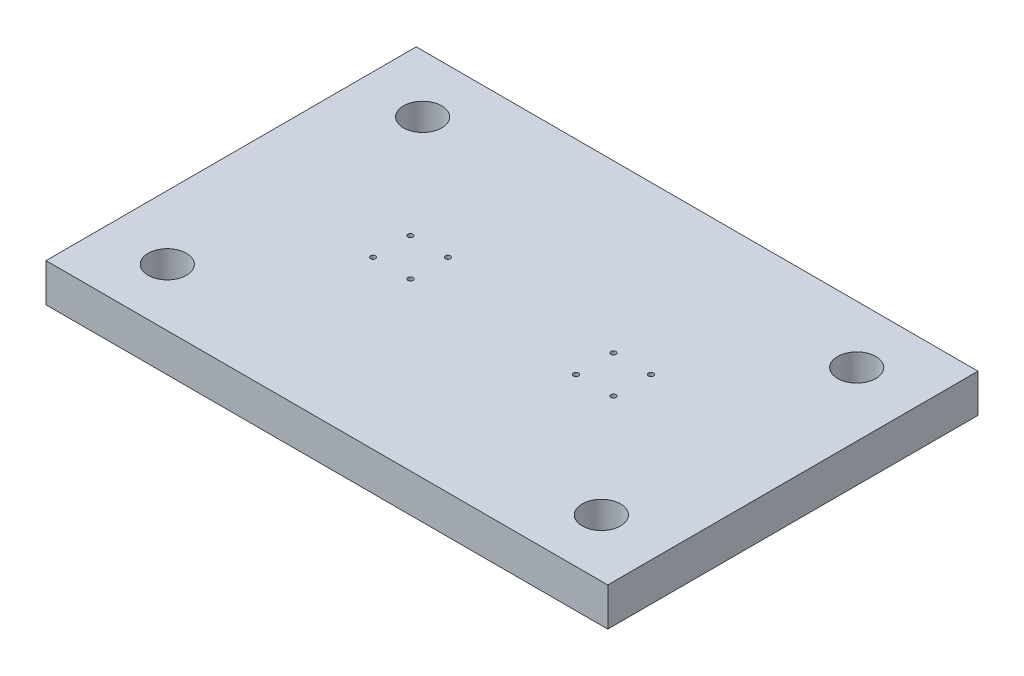
from build123d import *

# Parameters (mm, degrees)
SKETCH1_W           = 880
SKETCH1_H           = 580
BOSS_EXTRUDE1_DEPTH = 60
SKETCH2_R           = 30
CUT_EXTRUDE1_DEPTH  = 260
SKETCH4_R           = 4
CUT_EXTRUDE3_DEPTH  = 260


with BuildPart() as part:
    # Sketch1 → Boss-Extrude1 (new body)
    with BuildSketch(Plane(origin=(0, 0, 0), x_dir=(1, 0, 0), z_dir=(0, 1, 0))):
        Rectangle(SKETCH1_W, SKETCH1_H)
    extrude(amount=BOSS_EXTRUDE1_DEPTH)

    # Sketch2 → Cut-Extrude1 (cut)
    with BuildSketch(Plane(origin=(0, 60, 0), x_dir=(1, 0, 0), z_dir=(0, 1, 0))):
        with Locations(Location((-340, 200, 0), (0, 0, 270))):
            Circle(SKETCH2_R)
        with Locations(Location((340, 200, 0), (0, 0, 270))):
            Circle(SKETCH2_R)
        with Locations(Location((340, -200, 0), (0, 0, 270))):
            Circle(SKETCH2_R)
        with Locations(Location((-340, -200, 0), (0, 0, 270))):
            Circle(SKETCH2_R)
    extrude(amount=-CUT_EXTRUDE1_DEPTH, mode=Mode.SUBTRACT)

    # Sketch4 → Cut-Extrude3 (cut)
    with BuildSketch(Plane(origin=(0, 60, 0), x_dir=(1, 0, 0), z_dir=(0, 1, 0))):
        with Locations(Location((-129.655068581, 29.344931419, 0), (0, 0, 270))):
            Circle(SKETCH4_R)
        with Locations(Location((-129.655068581, -29.344931419, 0), (0, 0, 270))):
            Circle(SKETCH4_R)
        with Locations(Location((-188.344931419, -29.344931419, 0), (0, 0, 270))):
            Circle(SKETCH4_R)
        with Locations(Location((-188.344931419, 29.344931419, 0), (0, 0, 270))):
            Circle(SKETCH4_R)
        with Locations(Location((188.344931419, 29.344931419, 0), (0, 0, 270))):
            Circle(SKETCH4_R)
        with Locations(Location((188.344931419, -29.344931419, 0), (0, 0, 270))):
            Circle(SKETCH4_R)
        with Locations(Location((129.655068581, -29.344931419, 0), (0, 0, 270))):
            Circle(SKETCH4_R)
        with Locations(Location((129.655068581, 29.344931419, 0), (0, 0, 270))):
            Circle(SKETCH4_R)
    extrude(amount=-CUT_EXTRUDE3_DEPTH, mode=Mode.SUBTRACT)


solid = part.part
